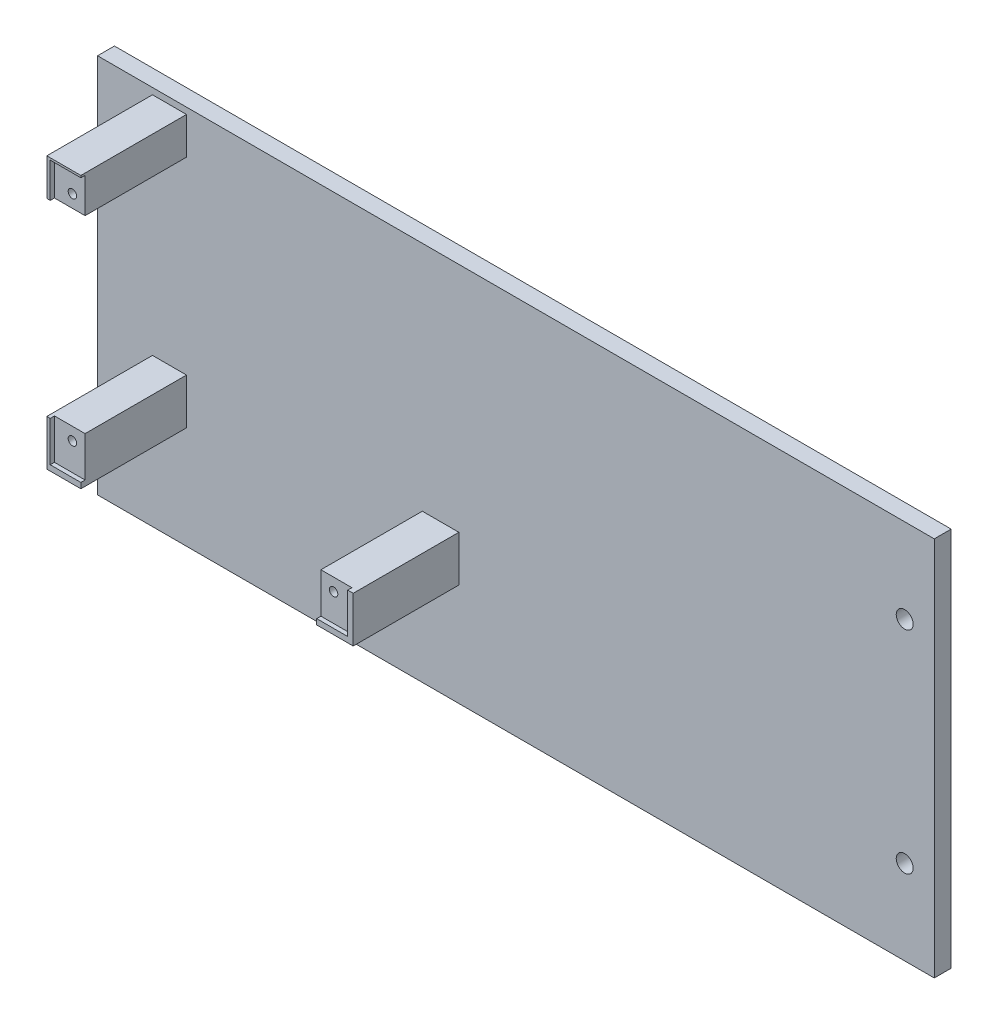
from build123d import *

# Parameters (mm, degrees)
SKETCH1_W               = 198
SKETCH1_H               = 90
BOSS_EXTRUDE1_DEPTH     = 4
SKETCH3_R               = 2
CUT_EXTRUDE1_DEPTH      = 10
SKETCH4_W               = 7.252652573
SKETCH4_H               = 8.265815716
SKETCH4_H_2             = 9.512006383
SKETCH4_W_2             = 7.344395692
BOSS_EXTRUDE3_DEPTH     = 24
BOSS_EXTRUDE4_DEPTH     = 25
CUT_EXTRUDE2_DEPTH      = 219.926928449
CUT_EXTRUDE2_DEPTH_BACK = 219.926928449
SKETCH4_5_R             = 1


with BuildPart() as part:
    # Sketch1 → Boss-Extrude1 (new body)
    with BuildSketch(Plane.XY):
        with Locations((99, 45)):
            Rectangle(SKETCH1_W, SKETCH1_H)
    extrude(amount=BOSS_EXTRUDE1_DEPTH)

    # Sketch3 → Cut-Extrude1 (cut)
    with BuildSketch(Plane(origin=(0, 0, 0), x_dir=(-1, 0, 0), z_dir=(0, 0, -1))):
        with Locations((-191, 20)):
            Circle(SKETCH3_R)
        with Locations((-191, 70)):
            Circle(SKETCH3_R)
        with Locations((-7, 20)):
            Circle(SKETCH3_R)
        with Locations((-7, 70)):
            Circle(SKETCH3_R)
    extrude(amount=-CUT_EXTRUDE1_DEPTH, mode=Mode.SUBTRACT)

    # Sketch4 → Boss-Extrude3 (add)
    with BuildSketch(Plane.XY.offset(4)):
        with Locations((17.426326287, 83.883092652)):
            Rectangle(SKETCH4_W, SKETCH4_H)
        with Locations((17.426326287, 30.336024443)):
            Rectangle(SKETCH4_W, SKETCH4_H_2)
        with Locations((80.527802154, 30.336024443)):
            Rectangle(SKETCH4_W_2, SKETCH4_H_2)
    extrude(amount=BOSS_EXTRUDE3_DEPTH)

    # Sketch4<4> → Boss-Extrude4 (add)
    with BuildSketch(Plane.XY.offset(4)):
        Polygon((13, 79.750184794), (13.8, 79.750184794), (13.8, 88.01600051), (21.052652573, 88.01600051), (21.052652573, 88.5), (13, 88.5), align=None)
        Polygon((13.8, 25.580021251), (13.8, 35.092027634), (13, 35.092027634), (13, 24.280021251), (21.052652573, 24.280021251), (21.052652573, 25.580021251), align=None)
        Polygon((85.5, 35.092027634), (84.2, 35.092027634), (84.2, 25.580021251), (76.855604308, 25.580021251), (76.855604308, 24.280021251), (85.5, 24.280021251), align=None)
    extrude(amount=BOSS_EXTRUDE4_DEPTH)

    # Sketch4<5> → Cut-Extrude2 (cut, two sides: drawn at the far end of the back side and taken through both)
    with BuildSketch(Plane.XY.offset(4).offset(-CUT_EXTRUDE2_DEPTH_BACK)):
        with Locations((79.855604308, 32.092027634)):
            Circle(SKETCH4_5_R)
        with Locations((18.052652573, 32.092027634)):
            Circle(SKETCH4_5_R)
        with Locations((18.052652573, 82.750184794)):
            Circle(SKETCH4_5_R)
    extrude(amount=CUT_EXTRUDE2_DEPTH + CUT_EXTRUDE2_DEPTH_BACK, mode=Mode.SUBTRACT)


solid = part.part
